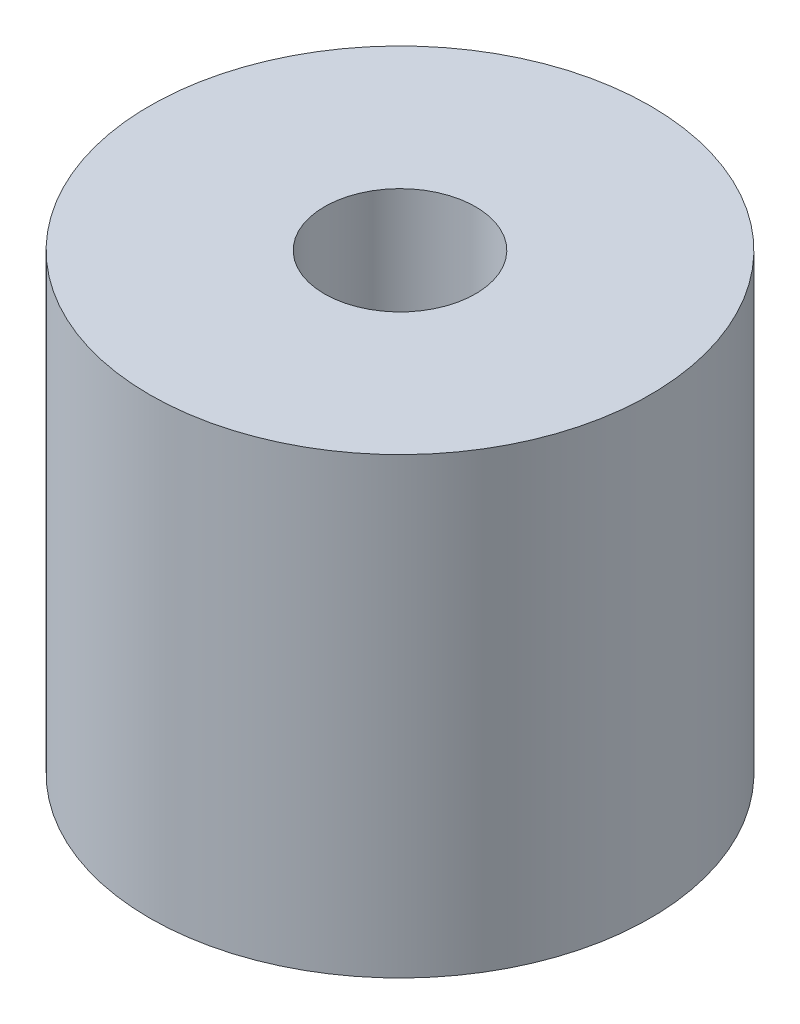
from build123d import *

# Parameters (mm, degrees)
SKETCH_1_R          = 2.65
EXTRUDE_1_DEPTH     = 4.8
SKETCH_2_R          = 0.8
CUT_EXTRUDE_1_DEPTH = 7.089745479


with BuildPart() as part:
    # 草图1 → 凸台-拉伸1 (new body)
    with BuildSketch(Plane(origin=(0, 0, 0), x_dir=(1, 0, 0), z_dir=(0, 1, 0))):
        Circle(SKETCH_1_R)
    extrude(amount=EXTRUDE_1_DEPTH)

    # 草图2 → 切除-拉伸1 (cut, through all)
    with BuildSketch(Plane(origin=(0, 4.8, 0), x_dir=(1, 0, 0), z_dir=(0, 1, 0))):
        Circle(SKETCH_2_R)
    extrude(amount=-CUT_EXTRUDE_1_DEPTH, mode=Mode.SUBTRACT)


solid = part.part
